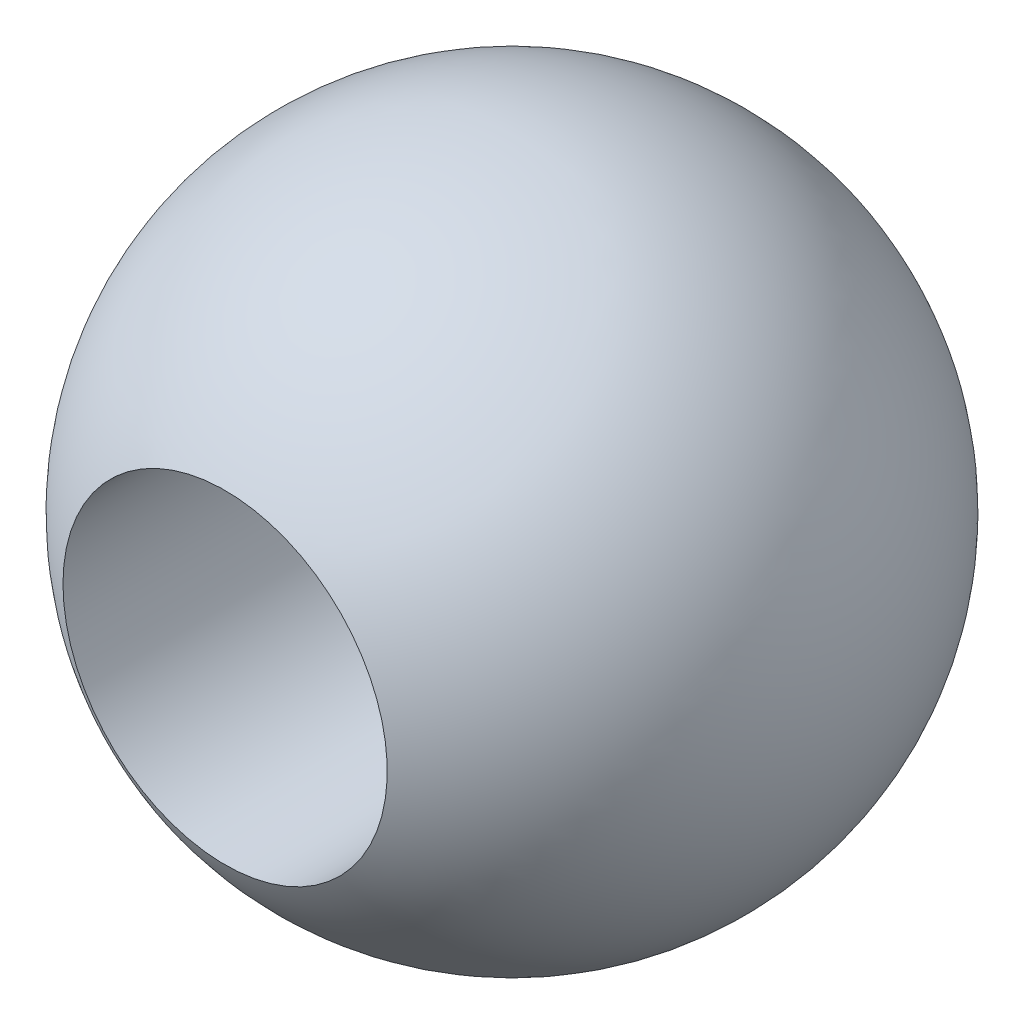
from build123d import *

# Parameters (mm, degrees)
CUT_EXTRUDE1_DEPTH      = 10
CUT_EXTRUDE1_DEPTH_BACK = 10
SKETCH2_R               = 1.55


with BuildPart() as part:
    # Sketch1 → Revolve1 (revolve)
    with BuildSketch(Plane.XY):
        with BuildLine():
            Line((0, 3.15), (0, -3.15))
            ThreePointArc((0, -3.15), (3.15, 0), (0, 3.15))
        make_face()
    revolve(axis=Axis((0, 0, 0), (0, -1, 0)))

    # Sketch2 → Cut-Extrude1 (cut, two sides: drawn at the far end of the back side and taken through both)
    with BuildSketch(Plane.XY.offset(-CUT_EXTRUDE1_DEPTH_BACK)):
        Circle(SKETCH2_R)
    extrude(amount=CUT_EXTRUDE1_DEPTH + CUT_EXTRUDE1_DEPTH_BACK, mode=Mode.SUBTRACT)


solid = part.part
